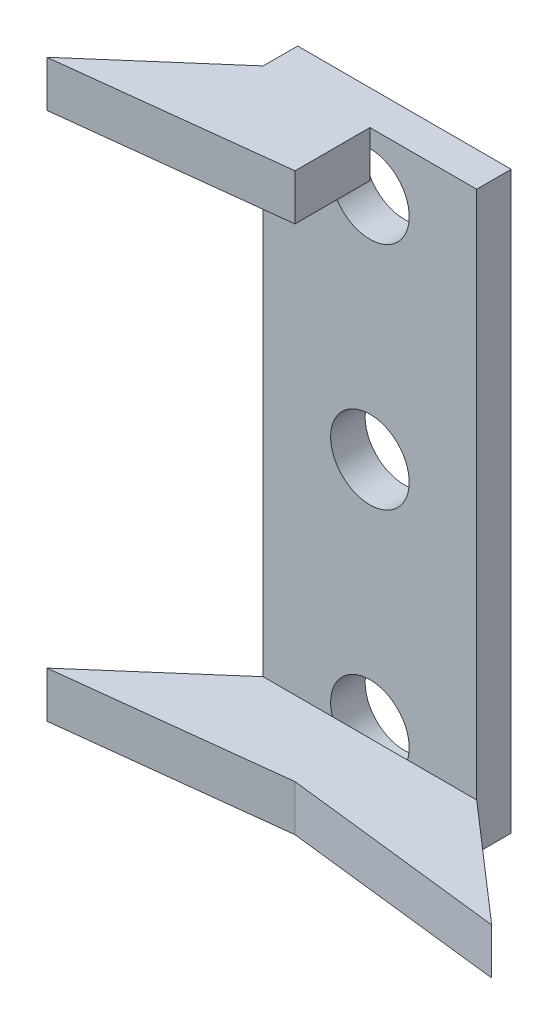
from build123d import *

# Parameters (mm, degrees)
BOSS_EXTRUDE1_DEPTH = 40
SKETCH3_W           = 185.690324397
SKETCH3_H           = 500
BOSS_EXTRUDE2_DEPTH = 30
SKETCH4_R           = 34.175984335
CUT_EXTRUDE1_DEPTH  = 30
LPATTERN1_COUNT     = 2
LPATTERN1_PITCH     = 200
LPATTERN1_COL_COUNT = 2
LPATTERN1_COL_PITCH = 200


with BuildPart() as part:
    # Sketch1 → Boss-Extrude1 (new body)
    with BuildSketch(Plane(origin=(0, 0, 0), x_dir=(1, 0, 0), z_dir=(0, 1, 0))):
        Polygon((-46.422581099, 32.577249894), (-147.004840148, -54.974109197), (46.422581099, -32.577249894), (46.422581099, 32.577249894), align=None)
    boss_extrude1 = extrude(amount=BOSS_EXTRUDE1_DEPTH)

    # Mirror1: Boss-Extrude1 across plane
    add(boss_extrude1.mirror(Plane(origin=(46.422581099, 40, -32.577249894), x_dir=(0, 0, 1), z_dir=(-1, 0, 0))))

    # Sketch3 → Boss-Extrude2 (add)
    with BuildSketch(Plane(origin=(0, 0, -32.577249894), x_dir=(-1, 0, 0), z_dir=(0, 0, -1))):
        with Locations((-46.422581099, 250)):
            Rectangle(SKETCH3_W, SKETCH3_H)
    extrude(amount=BOSS_EXTRUDE2_DEPTH)

    # Mirror5: Boss-Extrude1 across plane
    add(boss_extrude1.mirror(Plane.ZX.offset(250)))

    # Sketch4 → Cut-Extrude1 (cut)
    with BuildSketch(Plane(origin=(0, 0, -62.577249894), x_dir=(-1, 0, 0), z_dir=(0, 0, -1))):
        with Locations((-46.422581099, 250)):
            Circle(SKETCH4_R)
    cut_extrude1 = extrude(amount=-CUT_EXTRUDE1_DEPTH, mode=Mode.SUBTRACT)

    # LPattern1: Cut-Extrude1 ×2
    with Locations(*[(0, i * LPATTERN1_PITCH, 0) for i in range(1, LPATTERN1_COUNT)]):
        add(cut_extrude1, mode=Mode.SUBTRACT)

    # LPattern1 col: Cut-Extrude1 ×2
    with Locations(*[(0, -i * LPATTERN1_COL_PITCH, 0) for i in range(1, LPATTERN1_COL_COUNT)]):
        add(cut_extrude1, mode=Mode.SUBTRACT)


solid = part.part
